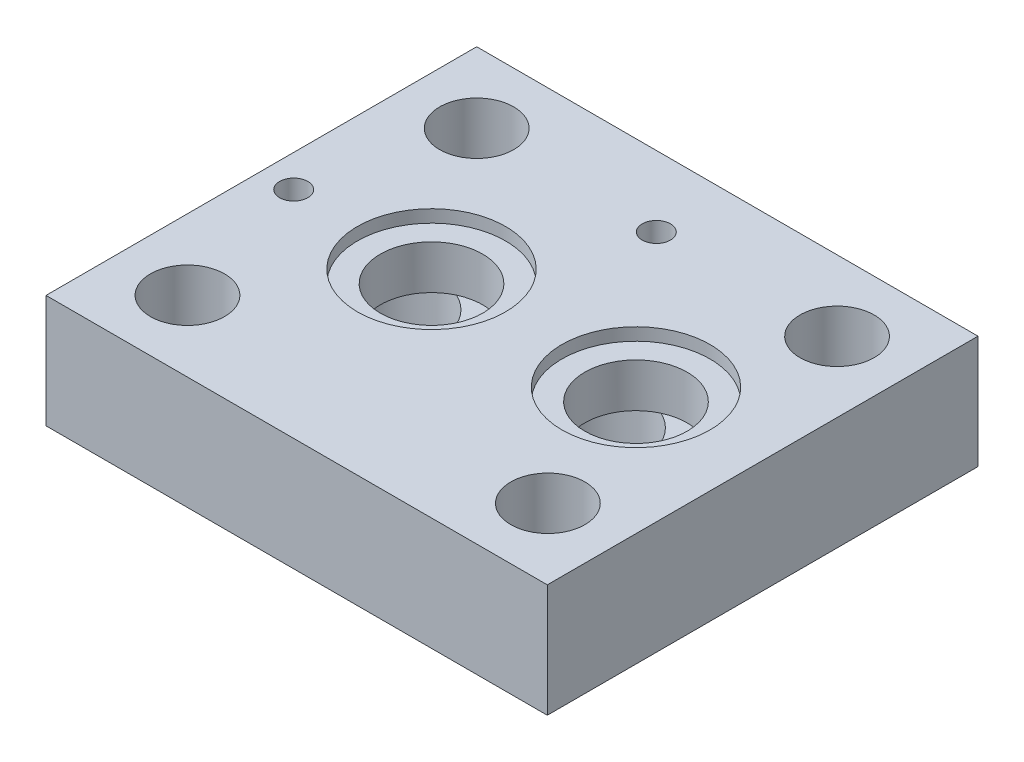
from build123d import *

# Parameters (mm, degrees)
SKETCH1_W           = 112.7125
SKETCH1_H           = 96.8375
BOSS_EXTRUDE1_DEPTH = 12.7
CUT_EXTRUDE2_START  = -12.7
SKETCH2_R           = 8.334375
CUT_EXTRUDE2_DEPTH  = 89.077000906
CUT_EXTRUDE4_START  = -12.7
SKETCH3_R           = 11.509375
CUT_EXTRUDE4_DEPTH  = 12.7
CUT_EXTRUDE6_START  = 12.7
SKETCH4_R           = 11.509375
CUT_EXTRUDE6_DEPTH  = 12.7
CUT_EXTRUDE8_START  = 12.7
SKETCH5_R           = 16.6497
CUT_EXTRUDE8_DEPTH  = 2.8194
CUT_EXTRUDE10_START = -12.7
SKETCH6_R           = 3.571875
CUT_EXTRUDE10_DEPTH = 7.9375
CUT_EXTRUDE12_START = 12.7
SKETCH7_R           = 3.175
CUT_EXTRUDE12_DEPTH = 7.9375


with BuildPart() as part:
    # Sketch1 → Boss-Extrude1 (new, symmetric)
    with BuildSketch(Plane(origin=(0, 0, 0), x_dir=(1, 0, 0), z_dir=(0, 1, 0))):
        Rectangle(SKETCH1_W, SKETCH1_H)
    extrude(amount=BOSS_EXTRUDE1_DEPTH, both=True)

    # Sketch2 → Cut-Extrude2 (cut, through all)
    with BuildSketch(Plane(origin=(0, 0, 0), x_dir=(1, 0, 0), z_dir=(0, 1, 0)).offset(CUT_EXTRUDE2_START)):
        with Locations(Location((-40.48125, -32.48025, 0), (0, 0, 270))):
            Circle(SKETCH2_R)
        with Locations(Location((40.54475, -32.48025, 0), (0, 0, 270))):
            Circle(SKETCH2_R)
        with Locations(Location((-40.48125, 32.54375, 0), (0, 0, 270))):
            Circle(SKETCH2_R)
        with Locations(Location((40.54475, 32.54375, 0), (0, 0, 270))):
            Circle(SKETCH2_R)
    extrude(amount=CUT_EXTRUDE2_DEPTH, mode=Mode.SUBTRACT)

    # Sketch3 → Cut-Extrude4 (cut)
    with BuildSketch(Plane(origin=(0, 0, 0), x_dir=(1, 0, 0), z_dir=(0, 1, 0)).offset(CUT_EXTRUDE4_START)):
        with Locations(Location((-27.78125, 0.03175, 0), (0, 0, 270))):
            Circle(SKETCH3_R)
        with Locations(Location((18.19275, 0.03175, 0), (0, 0, 270))):
            Circle(SKETCH3_R)
    extrude(amount=CUT_EXTRUDE4_DEPTH, mode=Mode.SUBTRACT)

    # Sketch4 → Cut-Extrude6 (cut)
    with BuildSketch(Plane(origin=(0, 0, 0), x_dir=(1, 0, 0), z_dir=(0, 1, 0)).offset(CUT_EXTRUDE6_START)):
        with Locations(Location((-18.12925, 0.03175, 0), (0, 0, 270))):
            Circle(SKETCH4_R)
        with Locations(Location((27.84475, 0.03175, 0), (0, 0, 270))):
            Circle(SKETCH4_R)
    extrude(amount=-CUT_EXTRUDE6_DEPTH, mode=Mode.SUBTRACT)

    # Sketch5 → Cut-Extrude8 (cut)
    with BuildSketch(Plane(origin=(0, 0, 0), x_dir=(1, 0, 0), z_dir=(0, 1, 0)).offset(CUT_EXTRUDE8_START)):
        with Locations(Location((-18.12925, 0.03175, 0), (0, 0, 270))):
            Circle(SKETCH5_R)
        with Locations(Location((27.84475, 0.03175, 0), (0, 0, 270))):
            Circle(SKETCH5_R)
    extrude(amount=-CUT_EXTRUDE8_DEPTH, mode=Mode.SUBTRACT)

    # Sketch6 → Cut-Extrude10 (cut)
    with BuildSketch(Plane(origin=(0, 0, 0), x_dir=(1, 0, 0), z_dir=(0, 1, 0)).offset(CUT_EXTRUDE10_START)):
        with Locations(Location((49.18075, 0.03175, 0), (0, 0, 270))):
            Circle(SKETCH6_R)
        with Locations(Location((0.15875, -32.48025, 0), (0, 0, 270))):
            Circle(SKETCH6_R)
    extrude(amount=CUT_EXTRUDE10_DEPTH, mode=Mode.SUBTRACT)

    # Sketch7 → Cut-Extrude12 (cut)
    with BuildSketch(Plane(origin=(0, 0, 0), x_dir=(1, 0, 0), z_dir=(0, 1, 0)).offset(CUT_EXTRUDE12_START)):
        with Locations(Location((-49.11725, 0.03175, 0), (0, 0, 270))):
            Circle(SKETCH7_R)
        with Locations(Location((-0.09525, 32.54375, 0), (0, 0, 270))):
            Circle(SKETCH7_R)
    extrude(amount=-CUT_EXTRUDE12_DEPTH, mode=Mode.SUBTRACT)


solid = part.part
